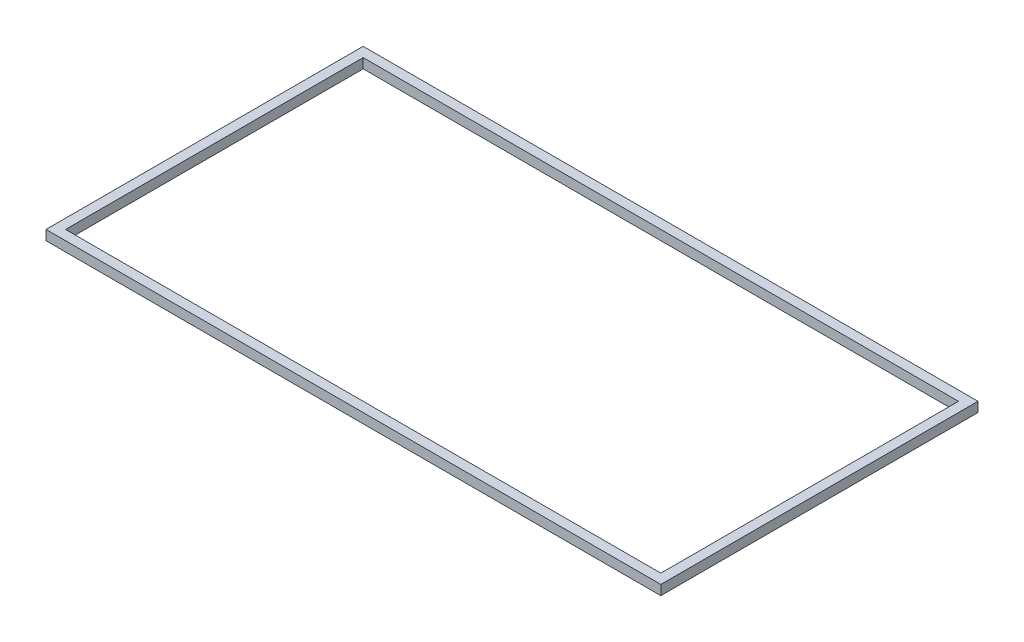
from build123d import *

# Parameters (mm, degrees)
SKETCH2_W           = 629.6
SKETCH2_H           = 324.8
SKETCH2_W_2         = 609.6
SKETCH2_H_2         = 304.8
EXTRUDE_THIN1_DEPTH = 10


with BuildPart() as part:
    # Sketch2 → Extrude-Thin1 (new body)
    with BuildSketch(Plane(origin=(0, 0, 0), x_dir=(1, 0, 0), z_dir=(0, 1, 0))):
        Rectangle(SKETCH2_W, SKETCH2_H)
        Rectangle(SKETCH2_W_2, SKETCH2_H_2, mode=Mode.SUBTRACT)
    extrude(amount=EXTRUDE_THIN1_DEPTH)


solid = part.part
